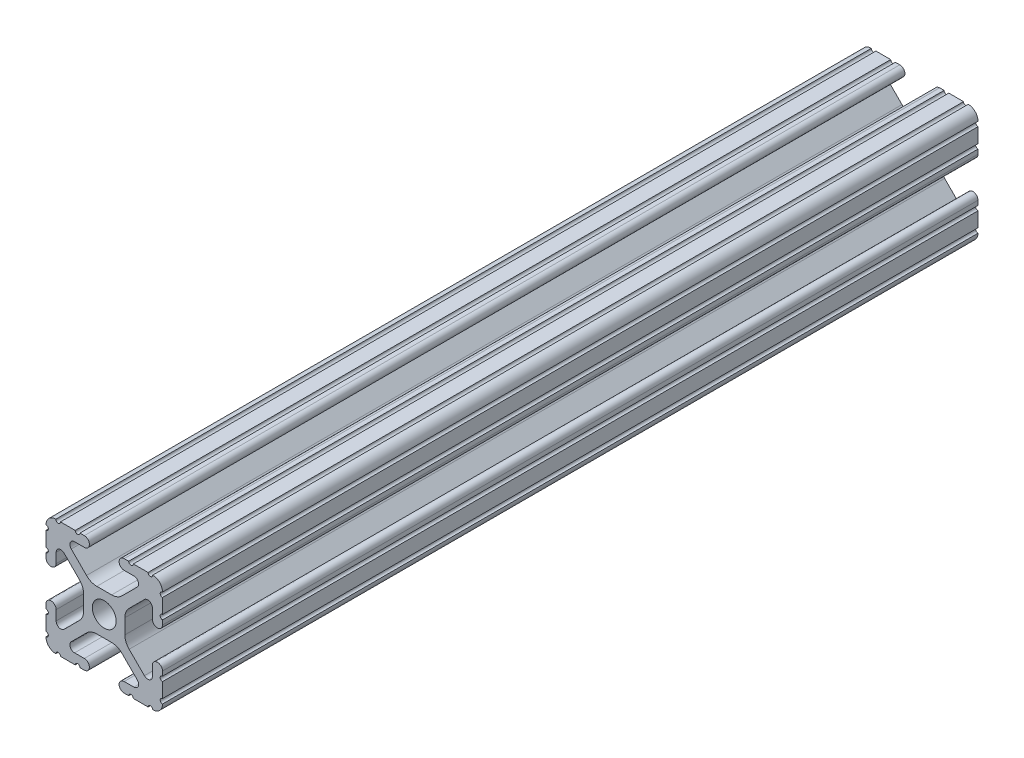
from build123d import *

# Parameters (mm, degrees)
SKETCH1_R           = 2.6035
BOSS_EXTRUDE1_DEPTH = 177.8


with BuildPart() as part:
    # Sketch1 → Boss-Extrude1 (new body)
    with BuildSketch(Plane(origin=(0, 0, -25.4), x_dir=(-1, 0, 0), z_dir=(0, 0, -1))):
        with BuildLine():
            Line((12.7, -9.5504), (12.7, -6.3330836))
            ThreePointArc((12.7, -6.3330836), (12.192, -5.8250836), (12.7, -5.3170836))
            Line((12.7, -5.3170836), (12.7, -4.3434))
            ThreePointArc((12.7, -4.3434), (11.5951, -3.2385), (10.4902, -4.3434))
            Line((10.4902, -4.3434), (10.4902, -6.474794456))
            ThreePointArc((10.4902, -6.474794456), (9.863006367, -7.413456061), (8.75577951, -7.193214945))
            Line((8.75577951, -7.193214945), (5.42573597, -3.863171405))
            ThreePointArc((5.42573597, -3.863171405), (4.737482484, -2.833127272), (4.4958, -1.618107374))
            Line((4.4958, -1.618107374), (4.4958, 1.618107374))
            ThreePointArc((4.4958, 1.618107374), (4.737482484, 2.833127272), (5.42573597, 3.863171405))
            Line((5.42573597, 3.863171405), (8.75577951, 7.193214945))
            ThreePointArc((8.75577951, 7.193214945), (9.863006367, 7.413456061), (10.4902, 6.474794456))
            Line((10.4902, 6.474794456), (10.4902, 4.343399971))
            ThreePointArc((10.4902, 4.343399971), (11.5951, 3.238499971), (12.7, 4.343399971))
            Line((12.7, 4.343399971), (12.7, 5.3170836))
            ThreePointArc((12.7, 5.3170836), (12.192, 5.8250836), (12.7, 6.3330836))
            Line((12.7, 6.3330836), (12.7, 9.5504))
            ThreePointArc((12.7, 9.5504), (12.192000006, 10.058323491), (12.699846982, 10.566399977))
            ThreePointArc((12.699846982, 10.566399977), (12.082522516, 12.082522516), (10.566399977, 12.699846982))
            ThreePointArc((10.566399977, 12.699846982), (10.058323491, 12.192000006), (9.5504, 12.7))
            Line((9.5504, 12.7), (6.3330836, 12.7))
            ThreePointArc((6.3330836, 12.7), (5.8250836, 12.192), (5.3170836, 12.7))
            Line((5.3170836, 12.7), (4.3434, 12.7))
            ThreePointArc((4.3434, 12.7), (3.2385, 11.5951), (4.3434, 10.4902))
            Line((4.3434, 10.4902), (6.474794456, 10.4902))
            ThreePointArc((6.474794456, 10.4902), (7.413456061, 9.863006367), (7.193214945, 8.75577951))
            Line((7.193214945, 8.75577951), (3.863171405, 5.42573597))
            ThreePointArc((3.863171405, 5.42573597), (2.833127272, 4.737482484), (1.618107374, 4.4958))
            Line((1.618107374, 4.4958), (-1.618107374, 4.4958))
            ThreePointArc((-1.618107374, 4.4958), (-2.833127272, 4.737482484), (-3.863171405, 5.42573597))
            Line((-3.863171405, 5.42573597), (-7.193214945, 8.75577951))
            ThreePointArc((-7.193214945, 8.75577951), (-7.413456061, 9.863006367), (-6.474794456, 10.4902))
            Line((-6.474794456, 10.4902), (-4.343399971, 10.4902))
            ThreePointArc((-4.343399971, 10.4902), (-3.238499971, 11.5951), (-4.343399971, 12.7))
            Line((-4.343399971, 12.7), (-5.3170836, 12.7))
            ThreePointArc((-5.3170836, 12.7), (-5.8250836, 12.192), (-6.3330836, 12.7))
            Line((-6.3330836, 12.7), (-9.5504, 12.7))
            ThreePointArc((-9.5504, 12.7), (-10.058323491, 12.192000006), (-10.566399977, 12.699846982))
            ThreePointArc((-10.566399977, 12.699846982), (-12.082522516, 12.082522516), (-12.699846982, 10.566399977))
            ThreePointArc((-12.699846982, 10.566399977), (-12.192000006, 10.058323491), (-12.7, 9.5504))
            Line((-12.7, 9.5504), (-12.7, 6.3330836))
            ThreePointArc((-12.7, 6.3330836), (-12.192, 5.8250836), (-12.7, 5.3170836))
            Line((-12.7, 5.3170836), (-12.7, 4.3434))
            ThreePointArc((-12.7, 4.3434), (-11.5951, 3.2385), (-10.4902, 4.3434))
            Line((-10.4902, 4.3434), (-10.4902, 6.474794456))
            ThreePointArc((-10.4902, 6.474794456), (-9.863006367, 7.413456061), (-8.75577951, 7.193214945))
            Line((-8.75577951, 7.193214945), (-5.42573597, 3.863171405))
            ThreePointArc((-5.42573597, 3.863171405), (-4.737482484, 2.833127272), (-4.4958, 1.618107374))
            Line((-4.4958, 1.618107374), (-4.4958, -1.618107374))
            ThreePointArc((-4.4958, -1.618107374), (-4.737482484, -2.833127272), (-5.42573597, -3.863171405))
            Line((-5.42573597, -3.863171405), (-8.75577951, -7.193214945))
            ThreePointArc((-8.75577951, -7.193214945), (-9.863006367, -7.413456061), (-10.4902, -6.474794456))
            Line((-10.4902, -6.474794456), (-10.4902, -4.343399971))
            ThreePointArc((-10.4902, -4.343399971), (-11.5951, -3.238499971), (-12.7, -4.343399971))
            Line((-12.7, -4.343399971), (-12.7, -5.3170836))
            ThreePointArc((-12.7, -5.3170836), (-12.192, -5.8250836), (-12.7, -6.3330836))
            Line((-12.7, -6.3330836), (-12.7, -9.5504))
            ThreePointArc((-12.7, -9.5504), (-12.192000006, -10.058323491), (-12.699846982, -10.566399977))
            ThreePointArc((-12.699846982, -10.566399977), (-12.082522516, -12.082522516), (-10.566399977, -12.699846982))
            ThreePointArc((-10.566399977, -12.699846982), (-10.058323491, -12.192000006), (-9.5504, -12.7))
            Line((-9.5504, -12.7), (-6.3330836, -12.7))
            ThreePointArc((-6.3330836, -12.7), (-5.8250836, -12.192), (-5.3170836, -12.7))
            Line((-5.3170836, -12.7), (-4.3434, -12.7))
            ThreePointArc((-4.3434, -12.7), (-3.2385, -11.5951), (-4.3434, -10.4902))
            Line((-4.3434, -10.4902), (-6.474794456, -10.4902))
            ThreePointArc((-6.474794456, -10.4902), (-7.413456061, -9.863006367), (-7.193214945, -8.75577951))
            Line((-7.193214945, -8.75577951), (-3.863171405, -5.42573597))
            ThreePointArc((-3.863171405, -5.42573597), (-2.833127272, -4.737482484), (-1.618107374, -4.4958))
            Line((-1.618107374, -4.4958), (1.618107374, -4.4958))
            ThreePointArc((1.618107374, -4.4958), (2.833127272, -4.737482484), (3.863171405, -5.42573597))
            Line((3.863171405, -5.42573597), (7.193214945, -8.75577951))
            ThreePointArc((7.193214945, -8.75577951), (7.413456061, -9.863006367), (6.474794456, -10.4902))
            Line((6.474794456, -10.4902), (4.343399971, -10.4902))
            ThreePointArc((4.343399971, -10.4902), (3.238499971, -11.5951), (4.343399971, -12.7))
            Line((4.343399971, -12.7), (5.3170836, -12.7))
            ThreePointArc((5.3170836, -12.7), (5.8250836, -12.192), (6.3330836, -12.7))
            Line((6.3330836, -12.7), (9.5504, -12.7))
            ThreePointArc((9.5504, -12.7), (10.058323491, -12.192000006), (10.566399977, -12.699846982))
            ThreePointArc((10.566399977, -12.699846982), (12.082522516, -12.082522516), (12.699846982, -10.566399977))
            ThreePointArc((12.699846982, -10.566399977), (12.192000006, -10.058323491), (12.7, -9.5504))
        make_face()
        with Locations(Location((0, 0, 0), (0, 0, 180))):
            Circle(SKETCH1_R, mode=Mode.SUBTRACT)
    extrude(amount=-BOSS_EXTRUDE1_DEPTH)


solid = part.part
